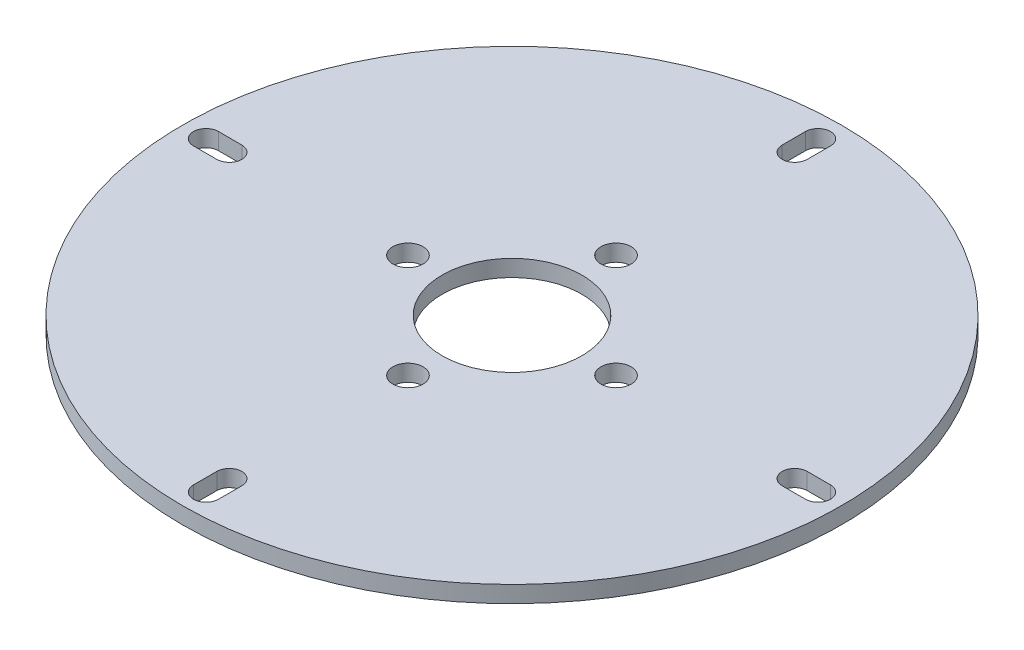
from build123d import *

# Parameters (mm, degrees)
SKETCH2_R           = 125.73
BOSS_EXTRUDE1_DEPTH = 6.35
SKETCH3_R           = 5.7546875
SKETCH3_R_2         = 26.67
CUT_EXTRUDE1_DEPTH  = 6.35


with BuildPart() as part:
    # Sketch2 → Boss-Extrude1 (new body)
    with BuildSketch(Plane(origin=(0, 0, 0), x_dir=(1, 0, 0), z_dir=(0, 1, 0))):
        with Locations(Location((0, 0, 0), (0, 0, 270))):
            Circle(SKETCH2_R)
    extrude(amount=BOSS_EXTRUDE1_DEPTH)

    # Sketch3 → Cut-Extrude1 (cut)
    with BuildSketch(Plane(origin=(0, 6.35, 0), x_dir=(1, 0, 0), z_dir=(0, 1, 0))):
        with Locations(Location((4.9245e-05, 39.6875, 0), (0, 0, 270))):
            Circle(SKETCH3_R)
        with Locations(Location((39.687549245, 0, 0), (0, 0, 270))):
            Circle(SKETCH3_R)
        with Locations(Location((4.9245e-05, -39.6875, 0), (0, 0, 270))):
            Circle(SKETCH3_R)
        with Locations(Location((-39.687450755, 0, 0), (0, 0, 270))):
            Circle(SKETCH3_R)
        with Locations(Location((0, 0, 0), (0, 0, 270))):
            Circle(SKETCH3_R_2)
        with BuildLine():
            Line((-4.7625, 107.85348), (-4.7625, 116.74348))
            ThreePointArc((-4.7625, 116.74348), (0, 121.50598), (4.7625, 116.74348))
            Line((4.7625, 116.74348), (4.7625, 107.85348))
            ThreePointArc((4.7625, 107.85348), (0, 103.09098), (-4.7625, 107.85348))
        make_face()
        with BuildLine():
            Line((107.853529245, 4.762549245), (116.743529245, 4.762549245))
            ThreePointArc((116.743529245, 4.762549245), (121.506029245, 4.9245e-05), (116.743529245, -4.762450755))
            Line((116.743529245, -4.762450755), (107.853529245, -4.762450755))
            ThreePointArc((107.853529245, -4.762450755), (103.091029245, 4.9245e-05), (107.853529245, 4.762549245))
        make_face()
        with BuildLine():
            Line((4.762598491, -107.85348), (4.762598491, -116.74348))
            ThreePointArc((4.762598491, -116.74348), (9.8491e-05, -121.50598), (-4.762401509, -116.74348))
            Line((-4.762401509, -116.74348), (-4.762401509, -107.85348))
            ThreePointArc((-4.762401509, -107.85348), (9.8491e-05, -103.09098), (4.762598491, -107.85348))
        make_face()
        with BuildLine():
            Line((-107.853430755, -4.762549245), (-116.743430755, -4.762549245))
            ThreePointArc((-116.743430755, -4.762549245), (-121.505930755, -4.9245e-05), (-116.743430755, 4.762450755))
            Line((-116.743430755, 4.762450755), (-107.853430755, 4.762450755))
            ThreePointArc((-107.853430755, 4.762450755), (-103.090930755, -4.9245e-05), (-107.853430755, -4.762549245))
        make_face()
    extrude(amount=-CUT_EXTRUDE1_DEPTH, mode=Mode.SUBTRACT)


solid = part.part
